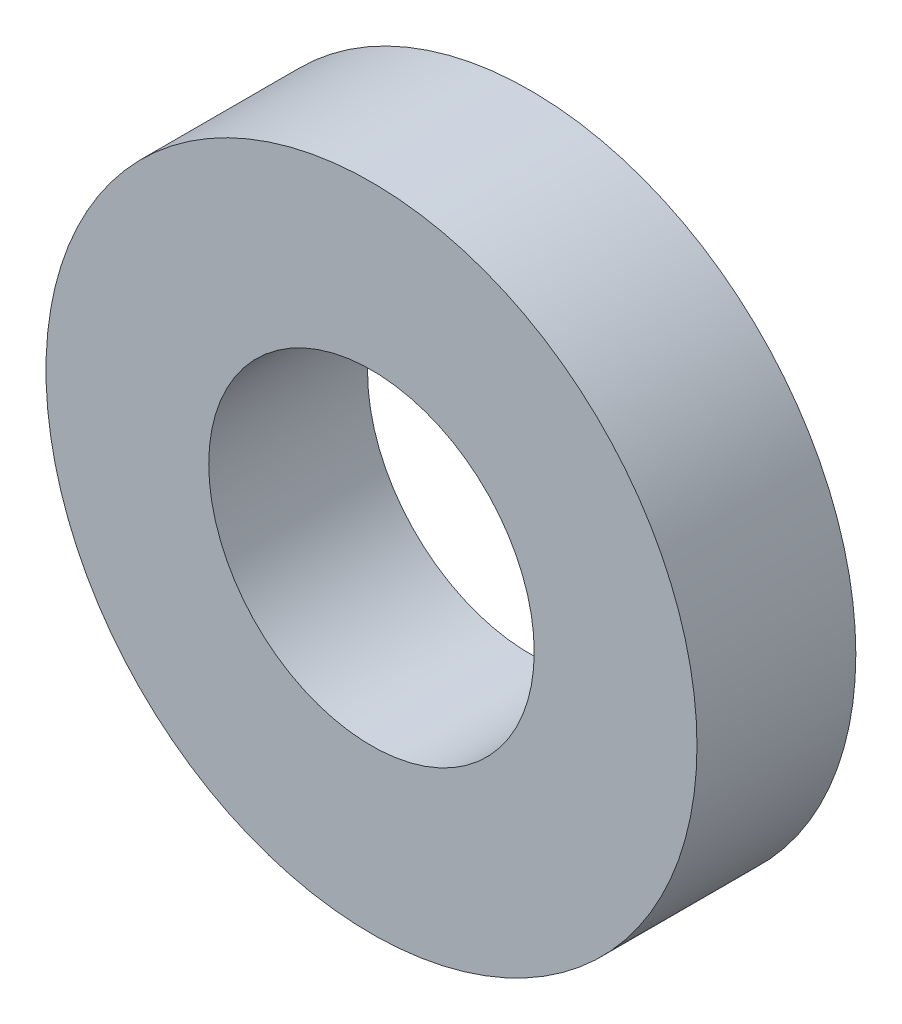
from build123d import *

# Parameters (mm, degrees)
SKETCH1_R           = 6.35
SKETCH1_R_2         = 3.175
BOSS_EXTRUDE1_DEPTH = 3.0988


with BuildPart() as part:
    # Sketch1 → Boss-Extrude1 (new body)
    with BuildSketch(Plane.XY):
        Circle(SKETCH1_R)
        Circle(SKETCH1_R_2, mode=Mode.SUBTRACT)
    extrude(amount=BOSS_EXTRUDE1_DEPTH)


solid = part.part
